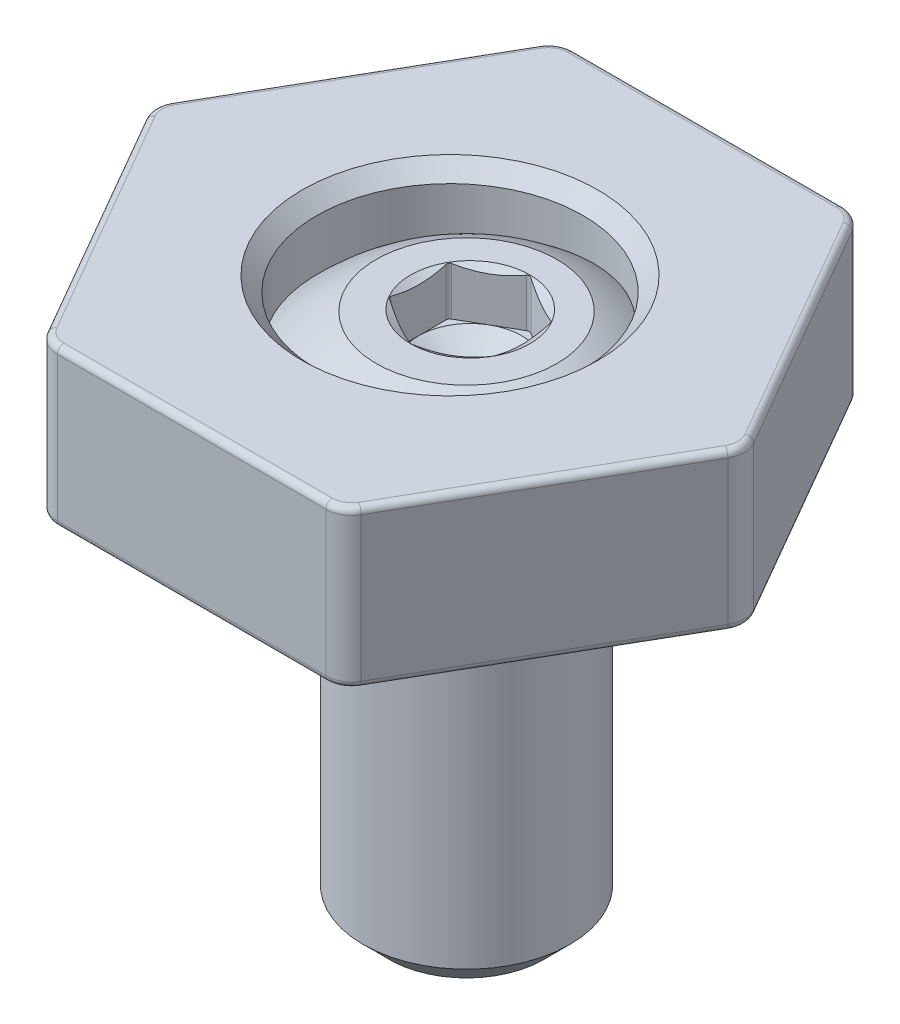
from build123d import *

# Parameters (mm, degrees)
SKETCH4_R           = 4.542971429
BOSS_EXTRUDE1_DEPTH = 4.826
FILLET1_R           = 0.1984375
SKETCH5_W           = 4.0259
SKETCH5_H           = 3.3528
CUT_EXTRUDE1_DEPTH  = 1.4986


with BuildPart() as part:
    # Sketch3 → Revolve1 (revolve)
    with BuildSketch(Plane.XY, mode=Mode.PRIVATE) as revolve1_sk:
        Polygon((-4.542971429, 8.382), (-4.0894, 7.928428571), (-4.0894, 4.318), (-3.8735, 4.318), (-3.8735, 3.556), (-7.9375, 3.556), (-7.9375, 8.382), align=None)
    revolve(revolve1_sk.sketch.rotate(Axis((0, -8.382, 0), (0, 1, 0)), 180), axis=Axis((0, -8.382, 0), (0, 1, 0)))

    # Sketch4 → Boss-Extrude1 (add)
    with BuildSketch(Plane(origin=(0, 8.382, 0), x_dir=(1, 0, 0), z_dir=(0, 1, 0))):
        with BuildLine():
            Line((4.124445986, 7.9375), (-4.124445986, 7.9375))
            ThreePointArc((-4.124445986, 7.9375), (-4.521320986, 7.831157664), (-4.81185365, 7.540625))
            Line((-4.81185365, 7.540625), (-8.936299635, 0.396875))
            ThreePointArc((-8.936299635, 0.396875), (-9.042641971, 0), (-8.936299635, -0.396875))
            Line((-8.936299635, -0.396875), (-4.81185365, -7.540625))
            ThreePointArc((-4.81185365, -7.540625), (-4.521320986, -7.831157664), (-4.124445986, -7.9375))
            Line((-4.124445986, -7.9375), (4.124445986, -7.9375))
            ThreePointArc((4.124445986, -7.9375), (4.521320986, -7.831157664), (4.81185365, -7.540625))
            Line((4.81185365, -7.540625), (8.936299635, -0.396875))
            ThreePointArc((8.936299635, -0.396875), (9.042641971, 0), (8.936299635, 0.396875))
            Line((8.936299635, 0.396875), (4.81185365, 7.540625))
            ThreePointArc((4.81185365, 7.540625), (4.521320986, 7.831157664), (4.124445986, 7.9375))
        make_face()
        Circle(SKETCH4_R, mode=Mode.SUBTRACT)
    extrude(amount=-BOSS_EXTRUDE1_DEPTH)

    # Fillet1
    fillet1_edges = [part.edges().sort_by_distance(p)[0] for p in [
        (-6.874076643, 3.556, 3.96875),
        (0, 3.556, 7.9375),
        (-4.521320986, 3.556, 7.831157664),
        (6.874076643, 3.556, 3.96875),
        (4.521320986, 3.556, 7.831157664),
        (6.874076643, 3.556, -3.96875),
        (9.042641971, 3.556, 0),
        (0, 3.556, -7.9375),
        (4.521320986, 3.556, -7.831157664),
        (-6.874076643, 3.556, -3.96875),
        (-4.521320986, 3.556, -7.831157664),
        (6.874076643, 8.382, 3.96875),
        (0, 8.382, 7.9375),
        (4.521320986, 8.382, 7.831157664),
        (-6.874076643, 8.382, 3.96875),
        (-4.521320986, 8.382, 7.831157664),
        (-6.874076643, 8.382, -3.96875),
        (-9.042641971, 8.382, 0),
        (0, 8.382, -7.9375),
        (-4.521320986, 8.382, -7.831157664),
        (6.874076643, 8.382, -3.96875),
        (4.521320986, 8.382, -7.831157664),
        (9.042641971, 8.382, 0),
        (-9.042641971, 3.556, 0),
    ]]
    fillet(fillet1_edges, radius=FILLET1_R)


with BuildPart() as body_2:
    # Sketch5 → Revolve2 (revolve)
    with BuildSketch(Plane.XY, mode=Mode.PRIVATE) as revolve2_sk:
        with Locations((2.01295, 5.9944)):
            Rectangle(SKETCH5_W, SKETCH5_H)
    revolve(revolve2_sk.sketch.rotate(Axis((0, 4.318, 0), (0, 1, 0)), 90), axis=Axis((0, 4.318, 0), (0, 1, 0)))

    # Sketch6 → Revolve3 (revolve)
    with BuildSketch(Plane.XY, mode=Mode.PRIVATE) as revolve3_sk:
        Polygon((0.508, 4.318), (3.683, 4.318), (3.683, -7.58825), (2.88925, -8.382), (0.508, -8.382), align=None)
    revolve(revolve3_sk.sketch.rotate(Axis((0.508, -8.382, 0), (0, 1, 0)), 90), axis=Axis((0.508, -8.382, 0), (0, 1, 0)))

    # Sketch7 → Cut-Revolve1 (revolve, cut)
    with BuildSketch(Plane.XY):
        with BuildLine():
            Line((6.703000764, 13.127905926), (6.703000764, 3.556))
            ThreePointArc((6.703000764, 3.556), (4.409975702, 6.979063374), (0.508, 8.301905926))
            Line((0.508, 8.301905926), (0.508, 13.127905926))
            Line((0.508, 13.127905926), (6.703000764, 13.127905926))
        make_face()
    revolve(axis=Axis((0.508, -8.382, 0), (0, 1, 0)), mode=Mode.SUBTRACT)

    # Sketch8 → Cut-Extrude1 (cut)
    with BuildSketch(Plane(origin=(0, 7.6708, 0), x_dir=(1, 0, 0), z_dir=(0, 1, 0))):
        with BuildLine():
            Line((-1.016, -0.838905294), (0.4445, -1.682125363))
            ThreePointArc((0.4445, -1.682125363), (0.508, -1.699140136), (0.5715, -1.682125363))
            Line((0.5715, -1.682125363), (2.032, -0.838905294))
            ThreePointArc((2.032, -0.838905294), (2.078485226, -0.792420068), (2.0955, -0.728920068))
            Line((2.0955, -0.728920068), (2.0955, 0.957520068))
            ThreePointArc((2.0955, 0.957520068), (2.078485226, 1.021020068), (2.032, 1.067505294))
            Line((2.032, 1.067505294), (0.5715, 1.910725363))
            ThreePointArc((0.5715, 1.910725363), (0.508, 1.927740136), (0.4445, 1.910725363))
            Line((0.4445, 1.910725363), (-1.016, 1.067505294))
            ThreePointArc((-1.016, 1.067505294), (-1.062485226, 1.021020068), (-1.0795, 0.957520068))
            Line((-1.0795, 0.957520068), (-1.0795, -0.728920068))
            ThreePointArc((-1.0795, -0.728920068), (-1.062485226, -0.792420068), (-1.016, -0.838905294))
        make_face()
    extrude(amount=-CUT_EXTRUDE1_DEPTH, mode=Mode.SUBTRACT)

    # Cut-Extrude2 cone 1 section (through the dimple's axis) → Cut-Extrude2 (revolve, cut)
    with BuildSketch(Plane(origin=(0.508, 6.1722, -0.1143), x_dir=(0, 0, 1), z_dir=(1, 0, 0))):
        Polygon((0, 0), (1.5875, 0), (0, 0.953866233), align=None)
    revolve(axis=Axis((0.508, 6.1722, -0.1143), (0, -1, 0)), mode=Mode.SUBTRACT)

    # Cut-Extrude3 cone 1 section (through the dimple's axis) → Cut-Extrude3 (revolve, cut)
    with BuildSketch(Plane(origin=(0.508, 7.6708, -0.1143), x_dir=(0, 0, 1), z_dir=(1, 0, 0))):
        Polygon((0, 0), (1.833087105, 0), (0, 1.058333333), align=None)
    revolve(axis=Axis((0.508, 7.6708, -0.1143), (0, -1, 0)), mode=Mode.SUBTRACT)


solid = Compound([part.part, body_2.part])
